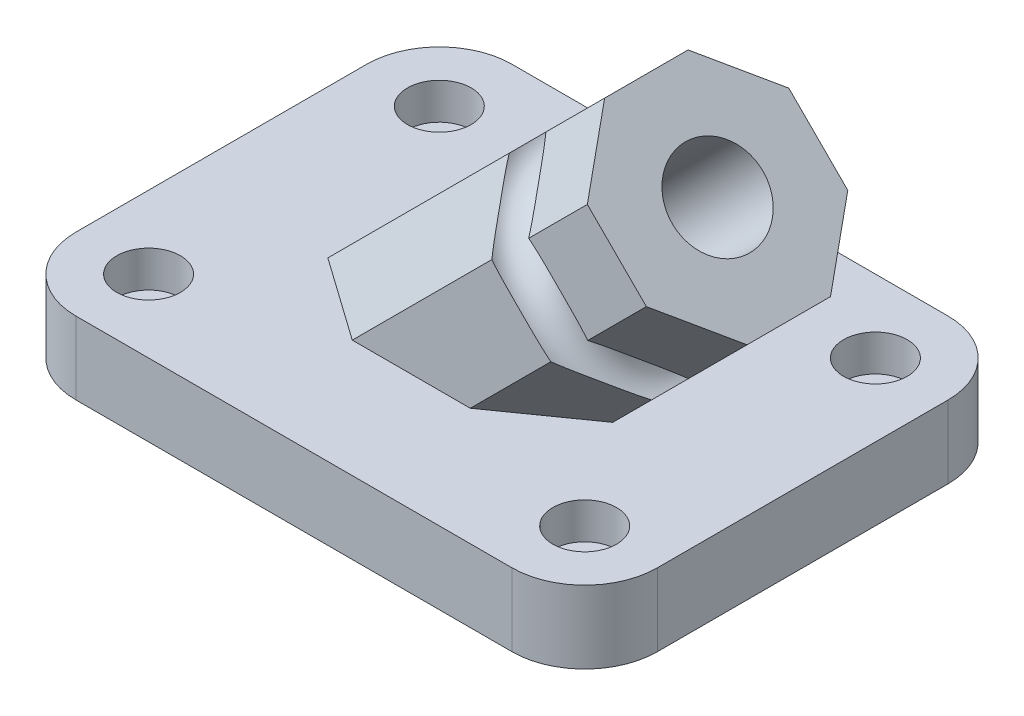
from build123d import *

# Parameters (mm, degrees)
BOTTOM_SKETCH_W                   = 101.6
BOTTOM_SKETCH_H                   = 76.2
BASE_EXTRUDE_DEPTH                = 12.7
CORNER_FILLETS_R                  = 12.7
TOP_CIRCULAR_SKETCH_R             = 5.5626
TOP_CIRCULAR_CUT_DEPTH            = 6.35
BOTTOM_CIRCULAR_SKETCH_R          = 3.3782
BOTTOM_CIRCULAR_CUT_DEPTH         = 64.816710194
HORIZONTAL_MIRROR_COPY_1_SKETCH_R = 5.5626
HORIZONTAL_MIRROR_COPY_1_DEPTH    = 6.35
HORIZONTAL_MIRROR_COPY_2_SKETCH_R = 3.3782
HORIZONTAL_MIRROR_COPY_2_DEPTH    = 64.816710194
OCTAGONAL_EXTRUDE_REACH           = 108.471
CENTER_SKETCH_R                   = 7.9375
CENTER_CUT_DEPTH                  = 110.090169628
RADIUS_SKETCH_R                   = 4.7752


with BuildPart() as part:
    # Bottom Sketch → Base Extrude (new body)
    with BuildSketch(Plane(origin=(0, 0, 0), x_dir=(1, 0, 0), z_dir=(0, 1, 0))):
        Rectangle(BOTTOM_SKETCH_W, BOTTOM_SKETCH_H)
    extrude(amount=BASE_EXTRUDE_DEPTH)

    # Corner Fillets
    corner_fillets_edges = [part.edges().sort_by_distance(p)[0] for p in [
        (-50.8, 6.35, -38.1),
        (50.8, 6.35, -38.1),
        (50.8, 6.35, 38.1),
        (-50.8, 6.35, 38.1),
    ]]
    fillet(corner_fillets_edges, radius=CORNER_FILLETS_R)

    # Top Circular Sketch → Top Circular Cut (cut)
    with BuildSketch(Plane(origin=(0, 12.7, 0), x_dir=(1, 0, 0), z_dir=(0, 1, 0))):
        with Locations(Location((-38.1, -25.4, 0), (0, 0, 270))):
            Circle(TOP_CIRCULAR_SKETCH_R)
    top_circular_cut = extrude(amount=-TOP_CIRCULAR_CUT_DEPTH, mode=Mode.SUBTRACT)

    # Bottom Circular Sketch → Bottom Circular Cut (cut, through all)
    with BuildSketch(Plane(origin=(0, 6.35, 0), x_dir=(1, 0, 0), z_dir=(0, 1, 0))):
        with Locations(Location((-38.1, -25.4, 0), (0, 0, 270))):
            Circle(BOTTOM_CIRCULAR_SKETCH_R)
    bottom_circular_cut = extrude(amount=-BOTTOM_CIRCULAR_CUT_DEPTH, mode=Mode.SUBTRACT)

    # Vertical Mirror: Top Circular Cut, Bottom Circular Cut across plane
    add(top_circular_cut.mirror(Plane.XY), mode=Mode.SUBTRACT)
    add(bottom_circular_cut.mirror(Plane.XY), mode=Mode.SUBTRACT)

    # Horizontal Mirror: Top Circular Cut, Bottom Circular Cut across plane
    add(top_circular_cut.mirror(Plane(origin=(0, 0, 0), x_dir=(0, 0, 1), z_dir=(1, 0, 0))), mode=Mode.SUBTRACT)
    add(bottom_circular_cut.mirror(Plane(origin=(0, 0, 0), x_dir=(0, 0, 1), z_dir=(1, 0, 0))), mode=Mode.SUBTRACT)

    # Horizontal Mirror copy 1 sketch → Horizontal Mirror copy 1 (cut)
    with BuildSketch(Plane(origin=(0, 12.7, 0), x_dir=(-1, 0, 0), z_dir=(0, 1, 0))):
        with Locations(Location((-38.1, -25.4, 0), (0, 0, 270))):
            Circle(HORIZONTAL_MIRROR_COPY_1_SKETCH_R)
    extrude(amount=-HORIZONTAL_MIRROR_COPY_1_DEPTH, mode=Mode.SUBTRACT)

    # Horizontal Mirror copy 2 sketch → Horizontal Mirror copy 2 (cut, through all)
    with BuildSketch(Plane(origin=(0, 6.35, 0), x_dir=(-1, 0, 0), z_dir=(0, 1, 0))):
        with Locations(Location((-38.1, -25.4, 0), (0, 0, 270))):
            Circle(HORIZONTAL_MIRROR_COPY_2_SKETCH_R)
    extrude(amount=-HORIZONTAL_MIRROR_COPY_2_DEPTH, mode=Mode.SUBTRACT)

    # Octagonal Extrude: up to this plane
    octagonal_extrude_end = Plane(origin=(0, 12.7, 0), z_dir=(0, 1, 0))
    # Octagonal Sketch → Octagonal Extrude (add, up to the surface)
    with BuildSketch(Plane(origin=(35.921024484, 48.621024484, 0), x_dir=(0.7071067811865488, -0.7071067811865462, 0), z_dir=(0.7071067811865462, 0.7071067811865488, 0)), mode=Mode.PRIVATE) as octagonal_extrude_sk1:
        Polygon((-7.290119387, 17.599905094), (-17.599905094, 7.290119387), (-17.599905094, -7.290119387), (-7.290119387, -17.599905094), (7.290119387, -17.599905094), (17.599905094, -7.290119387), (17.599905094, 7.290119387), (7.290119387, 17.599905094), align=None)
    octagonal_extrude_tool1 = split(extrude(octagonal_extrude_sk1.sketch, amount=-OCTAGONAL_EXTRUDE_REACH, mode=Mode.PRIVATE), bisect_by=octagonal_extrude_end, keep=Keep.BOTH, mode=Mode.PRIVATE)
    add(octagonal_extrude_tool1.solids().sort_by_distance((35.921024, 48.621024, 0))[0])

    # Center Sketch → Center Cut (cut, through all)
    with BuildSketch(Plane(origin=(42.271024484, 42.271024484, 0), x_dir=(0, 0, -1), z_dir=(0.7071067811865465, 0.7071067811865487, 0))):
        with Locations(Location((0, 8.980256121, 0), (0, 0, 90))):
            Circle(CENTER_SKETCH_R)
    extrude(amount=-CENTER_CUT_DEPTH, mode=Mode.SUBTRACT)

    # Radius Sketch → Radial Cut (revolve, cut)
    with BuildSketch(Plane(origin=(-6.35, 6.35, 0), x_dir=(0, 0, 1), z_dir=(-0.7071067811865478, 0.7071067811865472, 0)), mode=Mode.PRIVATE) as radial_cut_sk:
        with Locations((17.599905094, 40.730256121)):
            Circle(RADIUS_SKETCH_R)
    revolve(radial_cut_sk.sketch.rotate(Axis((0, 12.7, 0), (0.7071067811865462, 0.7071067811865488, 0)), 67.500000005), axis=Axis((0, 12.7, 0), (0.7071067811865462, 0.7071067811865488, 0)), mode=Mode.SUBTRACT)


solid = part.part
